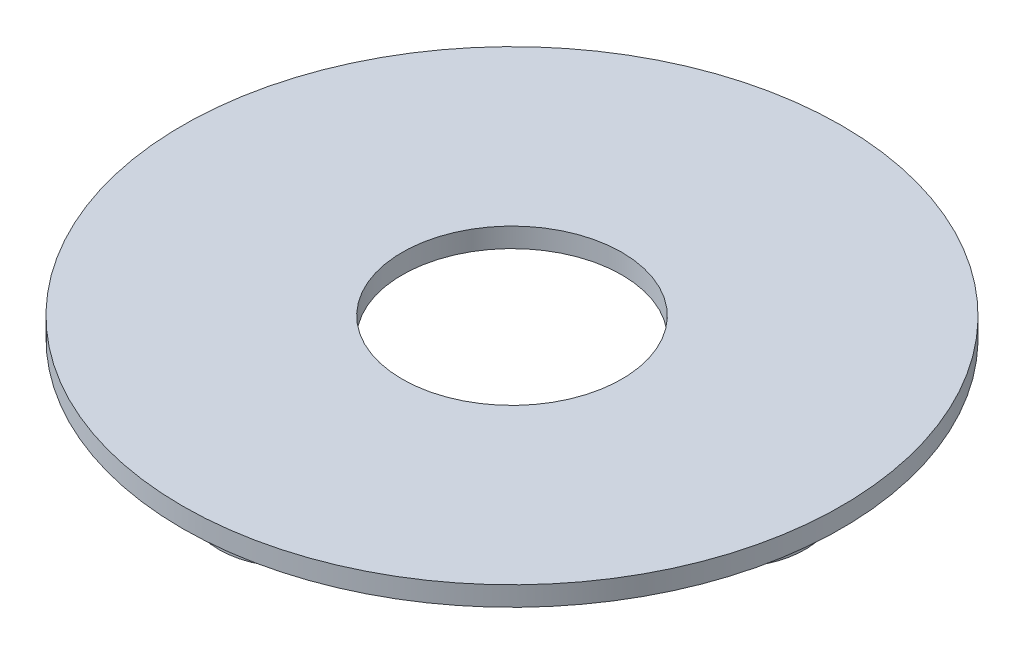
from build123d import *

# Parameters (mm, degrees)
SKETCH1_R           = 13.5
SKETCH1_R_2         = 4.5
BOSS_EXTRUDE1_DEPTH = 0.4
SKETCH2_R           = 3
BOSS_EXTRUDE3_DEPTH = 1.9


with BuildPart() as part:
    # Sketch1 → Boss-Extrude1 (new, symmetric)
    with BuildSketch(Plane(origin=(0, 0, 0), x_dir=(1, 0, 0), z_dir=(0, 1, 0))):
        with Locations(Location((0, 0, 0), (0, 0, 270))):
            Circle(SKETCH1_R)
        with Locations(Location((0, 0, 0), (0, 0, 270))):
            Circle(SKETCH1_R_2, mode=Mode.SUBTRACT)
    extrude(amount=BOSS_EXTRUDE1_DEPTH, both=True)

    # Sketch2 → Boss-Extrude3 (add)
    with BuildSketch(Plane(origin=(0, 0, 0), x_dir=(1, 0, 0), z_dir=(0, 1, 0))):
        with Locations(Location((0, 9, 0), (0, 0, 270))):
            Circle(SKETCH2_R)
        with Locations(Location((9, 0, 0), (0, 0, 270))):
            Circle(SKETCH2_R)
        with Locations(Location((-9, 0, 0), (0, 0, 270))):
            Circle(SKETCH2_R)
        with Locations(Location((0, -9, 0), (0, 0, 270))):
            Circle(SKETCH2_R)
    extrude(amount=-BOSS_EXTRUDE3_DEPTH)


solid = part.part
